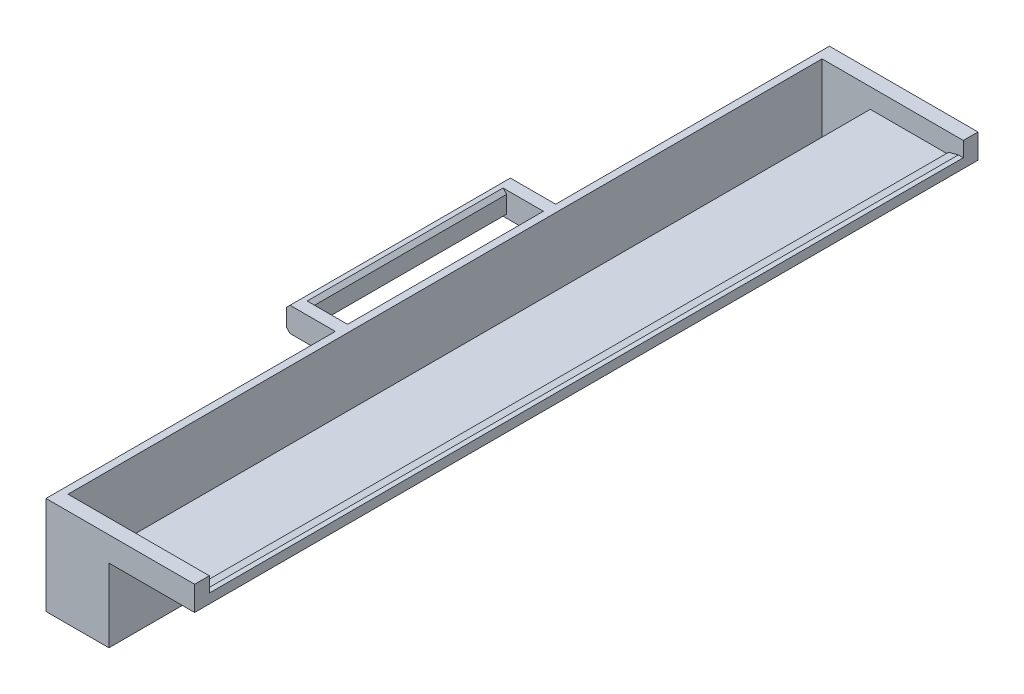
from build123d import *

# Parameters (mm, degrees)
BOSS_EXTRUDE1_DEPTH = 406.4
SKETCH4_W           = 73.282534648
SKETCH4_H           = 7.62
BOSS_EXTRUDE4_DEPTH = 10.16
BOSS_EXTRUDE5_START = -7.62
SKETCH7_W           = 25.022534648
SKETCH7_H           = 36.83
BOSS_EXTRUDE5_DEPTH = 7.62
BOSS_EXTRUDE6_START = -7.62
SKETCH11_W          = 25.022534648
SKETCH11_H          = 36.83
BOSS_EXTRUDE6_DEPTH = 7.62
BOSS_EXTRUDE7_DEPTH = 12.7
CHAMFER3_SIZE       = 1.905
CHAMFER4_SIZE       = 5.08
CHAMFER4_SIZE2      = 1.361181898


with BuildPart() as part:
    # Sketch1 → Boss-Extrude1 (new body)
    with BuildSketch(Plane.XY):
        Polygon((-36.83, -4.9276), (7.62, -4.9276), (7.62, 0), (0, 0), (0, -2.3876), (-29.21, -2.3876), (-40.64, -2.3876), (-40.64, -39.2176), (-65.662534648, -39.2176), (-65.662534648, 7.7724), (-69.472534648, 7.7724), (-69.472534648, -43.0276), (-36.83, -43.0276), align=None)
    extrude(amount=BOSS_EXTRUDE1_DEPTH)

    # Sketch4 → Boss-Extrude4 (add)
    with BuildSketch(Plane(origin=(0, -2.3876, 0), x_dir=(1, 0, 0), z_dir=(0, 1, 0))):
        with Locations((-29.021267324, -402.59)):
            Rectangle(SKETCH4_W, SKETCH4_H)
        with Locations((-29.021267324, -3.81)):
            Rectangle(SKETCH4_W, SKETCH4_H)
    extrude(amount=BOSS_EXTRUDE4_DEPTH)

    # Sketch7 → Boss-Extrude5 (add)
    with BuildSketch(Plane.XY.offset(406.4).offset(BOSS_EXTRUDE5_START)):
        with Locations((-53.151267324, -20.8026)):
            Rectangle(SKETCH7_W, SKETCH7_H)
    extrude(amount=BOSS_EXTRUDE5_DEPTH)

    # Sketch11 → Boss-Extrude6 (add)
    with BuildSketch(Plane(origin=(0, 0, 0), x_dir=(-1, 0, 0), z_dir=(0, 0, -1)).offset(BOSS_EXTRUDE6_START)):
        with Locations((53.151267324, -20.8026)):
            Rectangle(SKETCH11_W, SKETCH11_H)
    extrude(amount=BOSS_EXTRUDE6_DEPTH)

    # Sketch15 → Boss-Extrude7 (add)
    with BuildSketch(Plane(origin=(0, 7.7724, 0), x_dir=(1, 0, 0), z_dir=(0, 1, 0))):
        Polygon((-69.472534648, -256.308132937), (-69.472534648, -249.958132937), (-88.522534648, -249.958132937), (-88.522534648, -148.358132937), (-69.472534648, -148.358132937), (-69.472534648, -142.008132937), (-94.872534648, -142.008132937), (-94.872534648, -256.308132937), align=None)
    extrude(amount=-BOSS_EXTRUDE7_DEPTH)

    # Chamfer3
    chamfer3_edges = [part.edges().sort_by_distance(p)[0] for p in [
        (-88.522534648, -4.9276, 199.158132937),
        (-94.872534648, -4.9276, 199.158132937),
        (-94.872534648, 7.7724, 199.158132937),
        (-88.522534648, 7.7724, 199.158132937),
    ]]
    chamfer(chamfer3_edges, length=CHAMFER3_SIZE)

    # Chamfer4
    chamfer4_edges = [part.edges().sort_by_distance(p)[0] for p in [
        (0, 0, 203.2),
    ]]
    chamfer4_side = [part.faces().sort_by_distance(p)[0] for p in [
        (3.81, 0, 203.2),
    ]]
    chamfer(chamfer4_edges, length=CHAMFER4_SIZE, length2=CHAMFER4_SIZE2, reference=chamfer4_side[0])


solid = part.part
